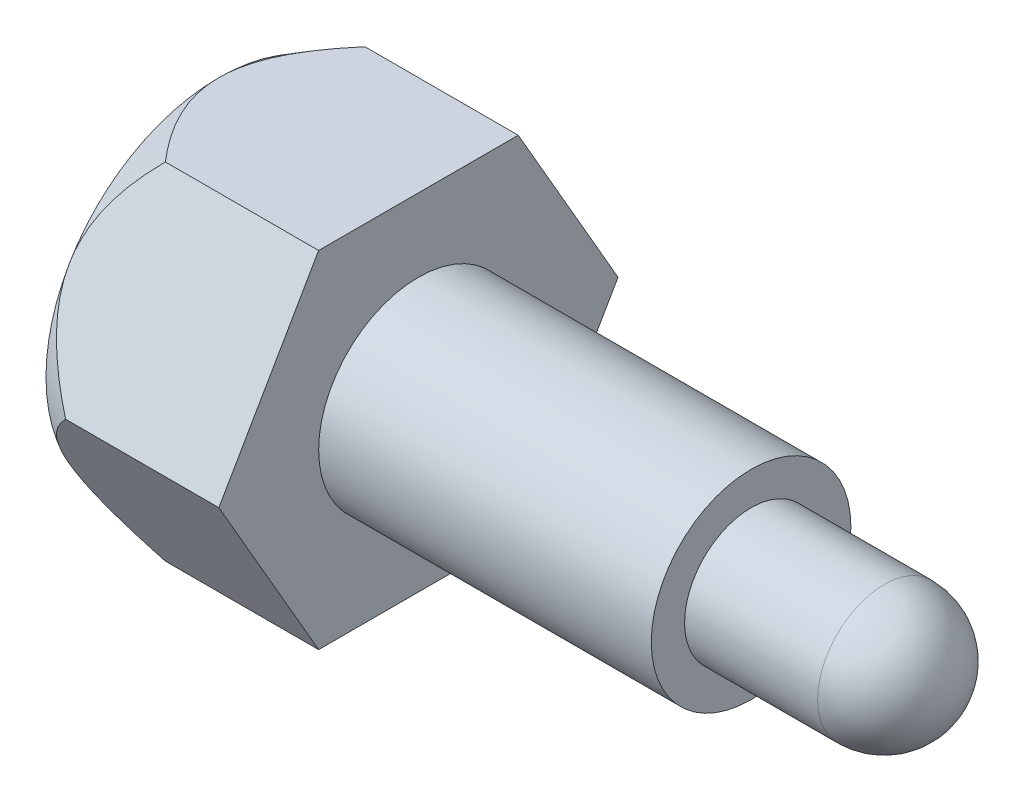
from build123d import *

# Parameters (mm, degrees)
DOME1_FACE_RADIUS  = 20
DOME1_HEIGHT       = 20
SKETCH3_OUTSIDE_W  = 177.57
SKETCH3_OUTSIDE_H  = 177.57
CUT_EXTRUDE4_DEPTH = 236.796522451
SKETCH5_OUTSIDE_W  = 447.476
SKETCH5_OUTSIDE_H  = 431.4
SKETCH5_OUTSIDE_R  = 51.961524227
CUT_EXTRUDE5_DEPTH = 234.880311271
CUT_EXTRUDE5_DRAFT = -30


with BuildPart() as part:
    # Sketch1 → Revolve2 (revolve)
    with BuildSketch(Plane(origin=(0, 0, 0), x_dir=(1, 0, 0), z_dir=(0, 1, 0)), mode=Mode.PRIVATE) as revolve2_sk:
        Polygon((0, 0), (0, 60), (60, 60), (60, 30), (160, 30), (160, 20), (200, 20), (200, 0), align=None)
    revolve(revolve2_sk.sketch.rotate(Axis((0, 0, 0), (1, 0, 0)), 180), axis=Axis((0, 0, 0), (1, 0, 0)))

    # Dome1: a dome of height H over a round flat face of radius A is a cap of a sphere of radius (A * A + H * H) / (2 * H)
    dome1_r = (DOME1_FACE_RADIUS * DOME1_FACE_RADIUS + DOME1_HEIGHT * DOME1_HEIGHT) / (2 * DOME1_HEIGHT)
    dome1_base = Plane((200, 0, 0), z_dir=(1, 0, 0))
    with Locations(dome1_base.offset(DOME1_HEIGHT - dome1_r)):
        dome1_ball = Sphere(dome1_r, mode=Mode.PRIVATE)
    add(split(dome1_ball, bisect_by=dome1_base, keep=Keep.TOP, mode=Mode.PRIVATE))

    # Sketch3 outside → Cut-Extrude4 (cut, through all)
    with BuildSketch(Plane.ZY):
        Rectangle(SKETCH3_OUTSIDE_W, SKETCH3_OUTSIDE_H)
        Polygon((60, 0), (30, 51.961524227), (-30, 51.961524227), (-60, 0), (-30, -51.961524227), (30, -51.961524227), align=None, mode=Mode.SUBTRACT)
    extrude(amount=-CUT_EXTRUDE4_DEPTH, mode=Mode.SUBTRACT)


with BuildPart() as cut_extrude5_tool:
    # Sketch5 outside → Cut-Extrude5 (with draft: the straight prism first)
    with BuildSketch(Plane.ZY):
        Rectangle(SKETCH5_OUTSIDE_W, SKETCH5_OUTSIDE_H)
        Circle(SKETCH5_OUTSIDE_R, mode=Mode.SUBTRACT)
    extrude(amount=-CUT_EXTRUDE5_DEPTH)
    # Cut-Extrude5: the draft: its side faces are tilted about the plane it starts from
    cut_extrude5_sides = [cut_extrude5_tool.faces().sort_by_distance(p)[0] for p in [
        (117.440155635, -215.7, 0),
        (117.440155635, 0, 223.738),
        (117.440155635, 215.7, 0),
        (117.440155635, 0, -223.738),
        (117.440155635, 0, -51.961524227),
    ]]
    draft(cut_extrude5_sides, Plane.ZY, CUT_EXTRUDE5_DRAFT)


with BuildPart() as part_1:
    add(part.part)

    # Cut-Extrude5: cut by cut_extrude5_tool
    add(cut_extrude5_tool.part, mode=Mode.SUBTRACT)


solid = part_1.part
